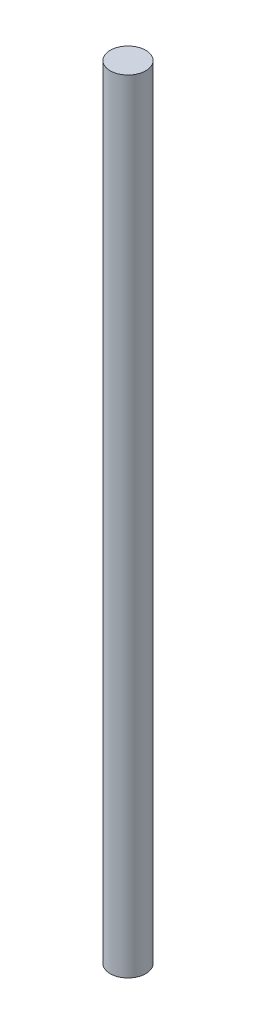
from build123d import *

# Parameters (mm, degrees)
SKETCH1_R           = 2.5
BOSS_EXTRUDE1_DEPTH = 110


with BuildPart() as part:
    # Sketch1 → Boss-Extrude1 (new body)
    with BuildSketch(Plane(origin=(0, 0, 0), x_dir=(1, 0, 0), z_dir=(0, 1, 0))):
        with Locations(Location((0, 0, 0), (0, 0, 270))):
            Circle(SKETCH1_R)
    extrude(amount=BOSS_EXTRUDE1_DEPTH)


solid = part.part
